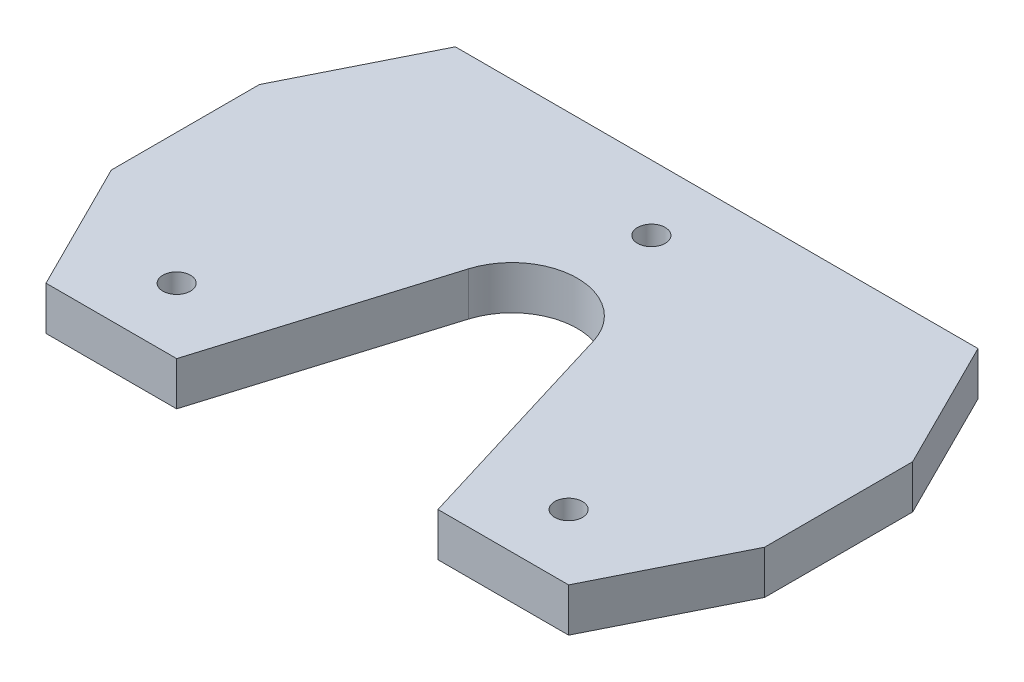
from build123d import *

# Parameters (mm, degrees)
SKETCH1_R           = 3.175
BOSS_EXTRUDE1_DEPTH = 10


with BuildPart() as part:
    # Sketch1 → Boss-Extrude1 (new body)
    with BuildSketch(Plane(origin=(0, 0, 0), x_dir=(1, 0, 0), z_dir=(0, 1, 0))):
        with BuildLine():
            Line((-60, 27.300970874), (60, 27.300970874))
            Line((60, 27.300970874), (75, -2.699029126))
            Line((75, -2.699029126), (75, -36.699029126))
            Line((75, -36.699029126), (60, -66.699029126))
            Line((60, -66.699029126), (30, -66.699029126))
            Line((30, -66.699029126), (14.348655784, -15.327387893))
            ThreePointArc((14.348655784, -15.327387893), (-0.000213283, -4.699029126), (-14.34901862, -15.327473931))
            Line((-14.34901862, -15.327473931), (-30, -66.699029126))
            Line((-30, -66.699029126), (-60, -66.699029126))
            Line((-60, -66.699029126), (-75, -36.699029126))
            Line((-75, -36.699029126), (-75, -2.699029126))
            Line((-75, -2.699029126), (-60, 27.300970874))
        make_face()
        with Locations(Location((-45, -51.699029126, 0), (0, 0, 270))):
            Circle(SKETCH1_R, mode=Mode.SUBTRACT)
        with Locations(Location((0, 12.300970874, 0), (0, 0, 270))):
            Circle(SKETCH1_R, mode=Mode.SUBTRACT)
        with Locations(Location((45, -51.699029126, 0), (0, 0, 270))):
            Circle(SKETCH1_R, mode=Mode.SUBTRACT)
    extrude(amount=BOSS_EXTRUDE1_DEPTH)


solid = part.part
